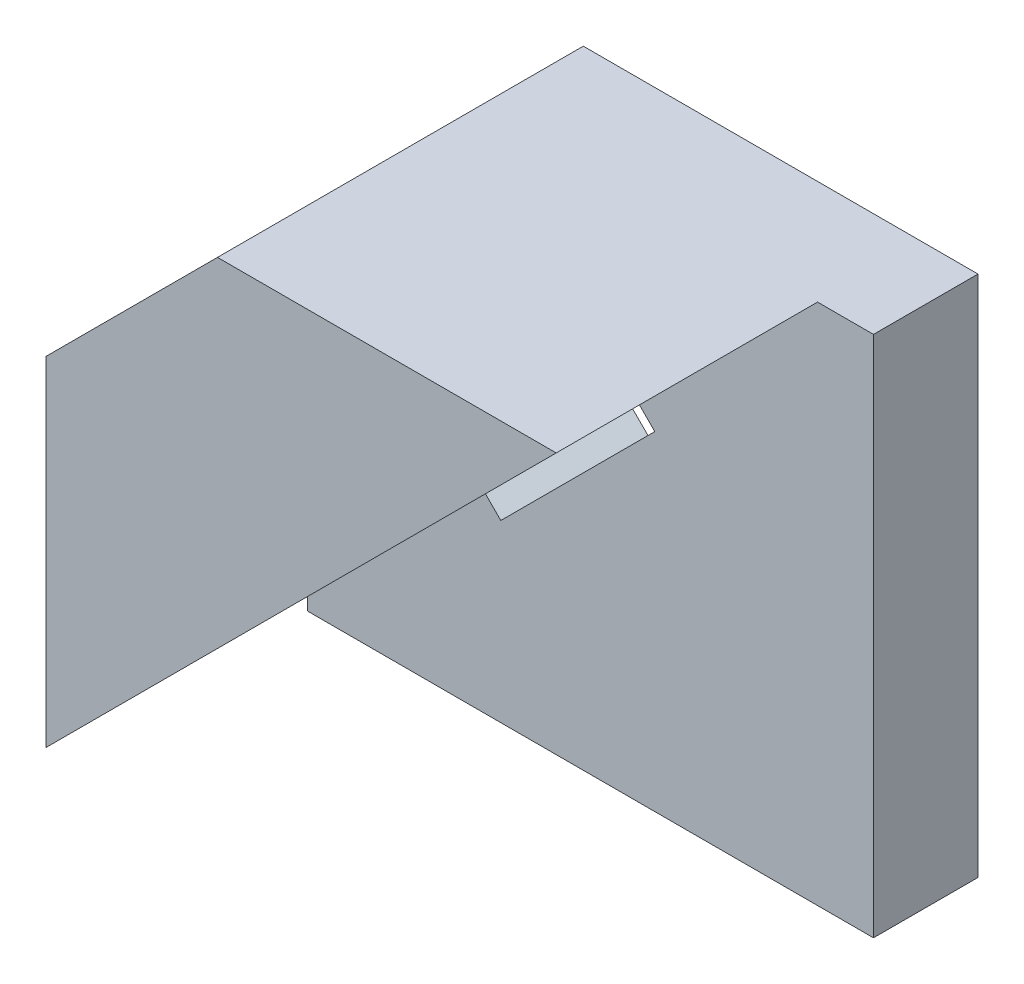
from build123d import *

# Parameters (mm, degrees)
BOSS_EXTRUDE1_DEPTH   = 27.432
BOSS_EXTRUDE2_DEPTH   = 5.08
SKETCH4_R             = 1.524
CUT_EXTRUDE1_DEPTH    = 2.286
SKETCH4_4_R           = 1.524
CUT_EXTRUDE2_DEPTH    = 63.630575033
BOSS_EXTRUDE3_DEPTH   = 3.81
FILLET1_R             = 2.54
CHAMFER3_SIZE         = 1.27
CHAMFER4_SIZE         = 0.254
SKETCH8_W             = 101.6
SKETCH8_H             = 44.45
CUT_EXTRUDE3_DEPTH    = 5.08
CHAMFER5_SIZE         = 1.27
BOSS_EXTRUDE4_DEPTH   = 6.096
FILLET2_R             = 1.27
CUT_EXTRUDE4_DEPTH    = 15.24
MIRROR3_COPY_1_DEPTH  = 15.24
CHAMFER7_SIZE         = 0.381
SKETCH19_W            = 135.869666512
SKETCH19_H            = 67.345799606
CUT_EXTRUDE9_DEPTH    = 31.242
BOSS_EXTRUDE6_DEPTH   = 20.32
SKETCH21_W            = 80.01
SKETCH21_H            = 52.07
BOSS_EXTRUDE7_DEPTH   = 3.81
FILLET3_R             = 2.54
CHAMFER8_SIZE         = 1.27
BOSS_EXTRUDE8_DEPTH   = 10.16
BOSS_EXTRUDE10_DEPTH  = 5.08
MIRROR13_COPY_1_DEPTH = 10.16
MIRROR13_COPY_2_DEPTH = 5.08
SKETCH27_W            = 107.092264377
SKETCH27_H            = 185.22400122
CUT_EXTRUDE11_DEPTH   = 177.054251014
SKETCH28_W            = 133.557103753
SKETCH28_H            = 91.2241148
CUT_EXTRUDE12_DEPTH   = 45.72


with BuildPart() as part:
    # Sketch1 → Boss-Extrude1 (new body)
    with BuildSketch(Plane(origin=(10.858740921, 0, 0), x_dir=(1, 0, 0), z_dir=(0, 0, 1))):
        Polygon((-52.705, 25.4), (-52.705, 21.59), (48.895, 21.59), (48.895, -22.86), (-52.705, -22.86), (-52.705, -25.4), (52.705, -25.4), (52.705, 25.4), align=None)
    extrude(amount=BOSS_EXTRUDE1_DEPTH)

    # Sketch1<3> → Boss-Extrude2 (add)
    with BuildSketch(Plane(origin=(10.858740921, 0, 0), x_dir=(1, 0, 0), z_dir=(0, 0, 1))):
        Polygon((48.895, 21.59), (-52.705, 21.59), (-52.705, 13.97), (-6.985, 13.97), (-6.985, -6.35), (-52.705, -6.35), (-52.705, -22.86), (48.895, -22.86), align=None)
    extrude(amount=BOSS_EXTRUDE2_DEPTH)

    # Sketch4 → Cut-Extrude1 (cut)
    # profile 1 of 4: a face of its own
    with BuildSketch(Plane(origin=(10.858740921, 0, 5.08), x_dir=(1, 0, 0), z_dir=(0, 0, 1))):
        Polygon((-44.785877438, 21.59), (-47.924122562, 21.59), (-49.493245123, 18.8722), (-47.924122562, 16.1544), (-44.785877438, 16.1544), (-43.216754877, 18.8722), align=None)
        with Locations((-46.355, 18.8722)):
            Circle(SKETCH4_R, mode=Mode.SUBTRACT)
    # profile 2 of 4: a face of its own
    with BuildSketch(Plane(origin=(10.858740921, 0, 5.08), x_dir=(1, 0, 0), z_dir=(0, 0, 1))):
        Polygon((21.126640721, 16.1544), (17.988395597, 16.1544), (16.419273036, 18.8722), (17.988395597, 21.59), (21.126640721, 21.59), (22.695763282, 18.8722), align=None)
        with Locations((19.557518159, 18.8722)):
            Circle(SKETCH4_R, mode=Mode.SUBTRACT)
    # profile 3 of 4: a face of its own
    with BuildSketch(Plane(origin=(10.858740921, 0, 5.08), x_dir=(1, 0, 0), z_dir=(0, 0, 1))):
        Polygon((22.695763282, -18.8722), (21.126640721, -16.1544), (17.988395597, -16.1544), (16.419273036, -18.8722), (17.988395597, -21.59), (21.126640721, -21.59), align=None)
        with Locations((19.557518159, -18.8722)):
            Circle(SKETCH4_R, mode=Mode.SUBTRACT)
    # profile 4 of 4: a face of its own
    with BuildSketch(Plane(origin=(10.858740921, 0, 5.08), x_dir=(1, 0, 0), z_dir=(0, 0, 1))):
        Polygon((-49.493245123, -18.8722), (-47.924122562, -16.1544), (-44.785877438, -16.1544), (-43.216754877, -18.8722), (-44.785877438, -21.59), (-47.924122562, -21.59), align=None)
        with Locations((-46.355, -18.8722)):
            Circle(SKETCH4_R, mode=Mode.SUBTRACT)
    extrude(amount=-CUT_EXTRUDE1_DEPTH, mode=Mode.SUBTRACT)

    # Sketch4<4> → Cut-Extrude2 (cut, through all)
    with BuildSketch(Plane(origin=(10.858740921, 0, 5.08), x_dir=(1, 0, 0), z_dir=(0, 0, 1))):
        with Locations((-46.355, 18.8722)):
            Circle(SKETCH4_4_R)
        with Locations((19.557518159, 18.8722)):
            Circle(SKETCH4_4_R)
        with Locations((-46.355, -18.8722)):
            Circle(SKETCH4_4_R)
        with Locations((19.557518159, -18.8722)):
            Circle(SKETCH4_4_R)
    extrude(amount=-CUT_EXTRUDE2_DEPTH, mode=Mode.SUBTRACT)

    # Sketch7 → Boss-Extrude3 (add)
    with BuildSketch(Plane(origin=(10.858740921, 0, 27.432), x_dir=(1, 0, 0), z_dir=(0, 0, 1))):
        Polygon((-52.705, 25.4), (52.705, 25.4), (52.705, -25.4), (-52.705, -25.4), (-52.705, -6.35), (-46.355, -6.35), (-46.355, 6.35), (-52.705, 6.35), align=None)
    extrude(amount=BOSS_EXTRUDE3_DEPTH)

    # Fillet1
    fillet1_edges = [part.edges().sort_by_distance(p)[0] for p in [
        (63.563740921, 25.4, 15.621),
        (63.563740921, -25.4, 15.621),
        (10.858740921, -25.4, 31.242),
        (63.563740921, 0, 31.242),
        (10.858740921, 25.4, 31.242),
    ]]
    fillet(fillet1_edges, radius=FILLET1_R)

    # Chamfer3
    chamfer3_edges = [part.edges().sort_by_distance(p)[0] for p in [
        (-41.846259079, 13.97, 27.432),
        (-41.846259079, 6.35, 29.337),
        (-41.846259079, 21.59, 16.256),
        (-41.846259079, -14.605, 27.432),
        (-41.846259079, -6.35, 29.337),
        (-38.671259079, 6.35, 31.242),
        (-35.496259079, 0, 31.242),
        (-38.671259079, -6.35, 31.242),
        (-41.846259079, -22.86, 16.256),
    ]]
    chamfer(chamfer3_edges, length=CHAMFER3_SIZE)

    # Chamfer4
    chamfer4_edges = [part.edges().sort_by_distance(p)[0] for p in [
        (28.892259079, 18.8722, 0),
        (-37.020259079, -18.8722, 0),
        (28.892259079, -18.8722, 0),
        (-37.020259079, 18.8722, 0),
    ]]
    chamfer(chamfer4_edges, length=CHAMFER4_SIZE)

    # Sketch8 → Cut-Extrude3 (cut)
    with BuildSketch(Plane(origin=(10.858740921, 0, 5.08), x_dir=(1, 0, 0), z_dir=(0, 0, 1))):
        with Locations((-1.905, -0.635)):
            Rectangle(SKETCH8_W, SKETCH8_H)
    extrude(amount=-CUT_EXTRUDE3_DEPTH, mode=Mode.SUBTRACT)

    # Chamfer5
    chamfer5_edges = [part.edges().sort_by_distance(p)[0] for p in [
        (-41.846259079, -22.86, 2.54),
        (-41.846259079, 21.59, 2.54),
    ]]
    chamfer(chamfer5_edges, length=CHAMFER5_SIZE)

    # Sketch9 → Boss-Extrude4 (add)
    with BuildSketch(Plane(origin=(10.858740921, 0, 0), x_dir=(-1, 0, 0), z_dir=(0, 0, -1))):
        Polygon((-90.741259079, 28.1), (-80.741259079, 38.1), (102.458740921, 38.1), (112.458740921, 28.1), (112.458740921, -28.1), (102.458740921, -38.1), (-80.741259079, -38.1), (-90.741259079, -28.1), align=None)
    extrude(amount=BOSS_EXTRUDE4_DEPTH)

    # Fillet2
    fillet2_edges = [part.edges().sort_by_distance(p)[0] for p in [
        (9.588740921, -25.4, 0),
        (63.563740921, 0, 0),
        (9.588740921, 25.4, 0),
        (62.819792145, 24.656051224, 0),
        (62.819792145, -24.656051224, 0),
    ]]
    fillet(fillet2_edges, radius=FILLET2_R)

    # Sketch13 → Cut-Extrude4 (cut)
    with BuildSketch(Plane(origin=(-64.85, 64.85, 0), x_dir=(0, 0, 1), z_dir=(-0.7071067811865477, 0.7071067811865474, 0))):
        Polygon((-6.096, -44.901280605), (-6.096, -42.070807846), (0, -38.551280605), (0, -51.251280605), (-6.096, -47.731753364), align=None)
    cut_extrude4 = extrude(amount=-CUT_EXTRUDE4_DEPTH, mode=Mode.SUBTRACT)

    # Mirror2: Cut-Extrude4 across plane
    add(cut_extrude4.mirror(Plane.ZX), mode=Mode.SUBTRACT)

    # Mirror3: Cut-Extrude4 across plane
    add(cut_extrude4.mirror(Plane(origin=(0, 0, 0), x_dir=(0, 0, 1), z_dir=(1, 0, 0))), mode=Mode.SUBTRACT)

    # Mirror3 copy 1 sketch → Mirror3 copy 1 (cut)
    with BuildSketch(Plane(origin=(64.85, -64.85, 0), x_dir=(0, 0, 1), z_dir=(0.7071067811865477, -0.7071067811865474, 0))):
        Polygon((-6.096, -44.901280605), (-6.096, -42.070807846), (0, -38.551280605), (0, -51.251280605), (-6.096, -47.731753364), align=None)
    extrude(amount=-MIRROR3_COPY_1_DEPTH, mode=Mode.SUBTRACT)

    # Chamfer7
    chamfer7_edges = [part.edges().sort_by_distance(p)[0] for p in [
        (-99.845787271, 29.854212729, -3.048),
        (-93.354212729, 36.345787271, -3.048),
        (-99.845787271, -29.854212729, -3.048),
        (-93.354212729, -36.345787271, -3.048),
        (99.845787271, 29.854212729, -3.048),
        (93.354212729, 36.345787271, -3.048),
        (99.845787271, -29.854212729, -3.048),
        (93.354212729, -36.345787271, -3.048),
    ]]
    chamfer(chamfer7_edges, length=CHAMFER7_SIZE)

    # Sketch19 → Cut-Extrude9 (cut)
    with BuildSketch(Plane.XY.offset(31.242)):
        Rectangle(SKETCH19_W, SKETCH19_H)
    extrude(amount=-CUT_EXTRUDE9_DEPTH, mode=Mode.SUBTRACT)

    # Sketch20 → Boss-Extrude6 (add)
    with BuildSketch(Plane.XY):
        Polygon((65.405, 22.86), (65.405, -21.59), (-10.795, -21.59), (-10.795, -25.4), (69.215, -25.4), (69.215, 26.67), (-10.795, 26.67), (-10.795, 22.86), align=None)
    extrude(amount=BOSS_EXTRUDE6_DEPTH)

    # Sketch21 → Boss-Extrude7 (add)
    with BuildSketch(Plane.XY.offset(20.32)):
        with Locations((29.21, 0.635)):
            Rectangle(SKETCH21_W, SKETCH21_H)
    extrude(amount=BOSS_EXTRUDE7_DEPTH)

    # Fillet3
    fillet3_edges = [part.edges().sort_by_distance(p)[0] for p in [
        (29.21, -25.4, 0),
        (69.215, 0.635, 0),
        (69.215, -25.4, 12.065),
        (29.21, 26.67, 0),
        (69.215, 26.67, 12.065),
        (29.21, -25.4, 24.13),
        (69.215, 0.635, 24.13),
        (29.21, 26.67, 24.13),
    ]]
    fillet(fillet3_edges, radius=FILLET3_R)

    # Chamfer8
    chamfer8_edges = [part.edges().sort_by_distance(p)[0] for p in [
        (-10.795, 22.86, 10.16),
        (-10.795, -21.59, 10.16),
        (-10.795, 0.635, 20.32),
    ]]
    chamfer(chamfer8_edges, length=CHAMFER8_SIZE)

    # Sketch24 → Boss-Extrude8 (add)
    with BuildSketch(Plane.XY):
        Polygon((-90.762833521, 19.180603012), (-101.6, 8.343436534), (-101.6, 28.1), (-100.641115254, 29.058884746), align=None)
        Polygon((-92.558884746, 37.141115254), (-91.6, 38.1), (-71.843436534, 38.1), (-82.680603012, 27.262833521), align=None)
    boss_extrude8 = extrude(amount=BOSS_EXTRUDE8_DEPTH)

    # Sketch26 → Boss-Extrude10 (add)
    with BuildSketch(Plane.XY.offset(10.16)):
        Polygon((-101.6, 8.343436534), (-71.843436534, 38.1), (-91.6, 38.1), (-101.6, 28.1), align=None)
    boss_extrude10 = extrude(amount=BOSS_EXTRUDE10_DEPTH)

    # Mirror12: Boss-Extrude8, Boss-Extrude10 across plane
    add(boss_extrude8.mirror(Plane.ZX))
    add(boss_extrude10.mirror(Plane.ZX))

    # Mirror13: Boss-Extrude8, Boss-Extrude10 across plane
    add(boss_extrude8.mirror(Plane(origin=(0, 0, 0), x_dir=(0, 0, 1), z_dir=(1, 0, 0))))
    add(boss_extrude10.mirror(Plane(origin=(0, 0, 0), x_dir=(0, 0, 1), z_dir=(1, 0, 0))))

    # Mirror13 copy 1 sketch → Mirror13 copy 1 (add)
    with BuildSketch(Plane(origin=(0, 0, 0), x_dir=(-1, 0, 0), z_dir=(0, 0, 1))):
        Polygon((-90.762833521, 19.180603012), (-101.6, 8.343436534), (-101.6, 28.1), (-100.641115254, 29.058884746), align=None)
        Polygon((-92.558884746, 37.141115254), (-91.6, 38.1), (-71.843436534, 38.1), (-82.680603012, 27.262833521), align=None)
    extrude(amount=MIRROR13_COPY_1_DEPTH)

    # Mirror13 copy 2 sketch → Mirror13 copy 2 (add)
    with BuildSketch(Plane(origin=(0, 0, 10.16), x_dir=(-1, 0, 0), z_dir=(0, 0, 1))):
        Polygon((-101.6, 8.343436534), (-71.843436534, 38.1), (-91.6, 38.1), (-101.6, 28.1), align=None)
    extrude(amount=MIRROR13_COPY_2_DEPTH)

    # Sketch27 → Cut-Extrude11 (cut, through all)
    with BuildSketch(Plane.ZY.offset(68.58)):
        with Locations((3.455221188, 0)):
            Rectangle(SKETCH27_W, SKETCH27_H)
    extrude(amount=-CUT_EXTRUDE11_DEPTH, mode=Mode.SUBTRACT)

    # Sketch28 → Cut-Extrude12 (cut)
    with BuildSketch(Plane.XZ.offset(38.1)):
        with Locations((-79.914224937, 5.971845756)):
            Rectangle(SKETCH28_W, SKETCH28_H)
    extrude(amount=-CUT_EXTRUDE12_DEPTH, mode=Mode.SUBTRACT)


solid = part.part
